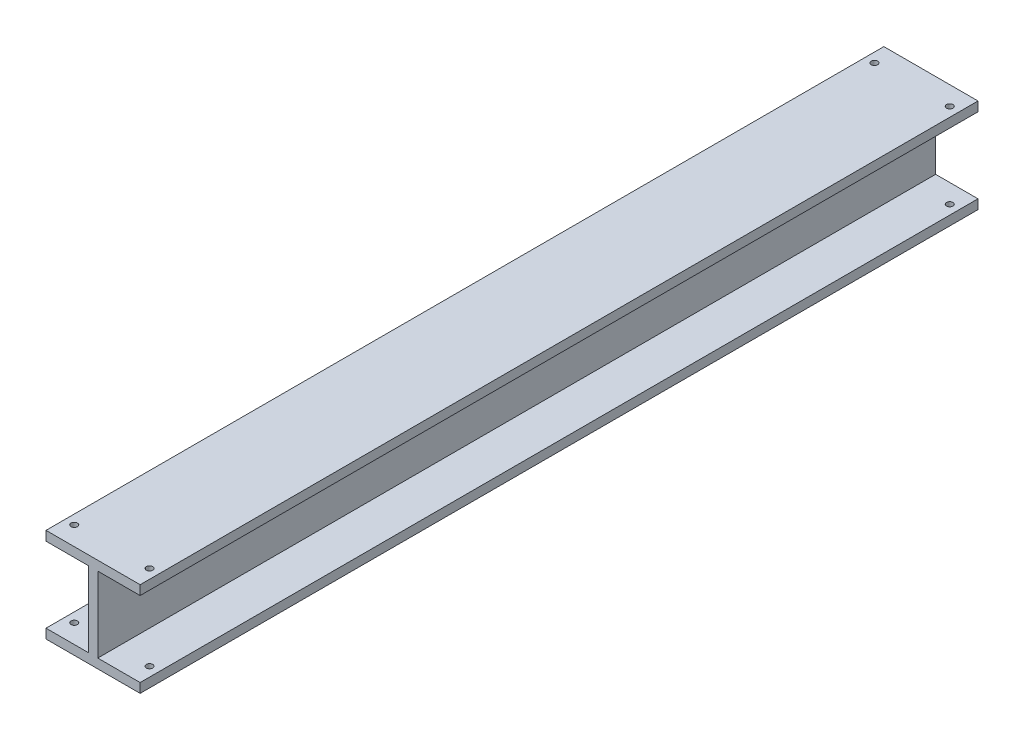
from build123d import *

# Parameters (mm, degrees)
AUFSATZ_LINEAR_AUSTRAGEN1_DEPTH = 890
SKIZZE2_R                       = 3.4
SCHNITT_LINEAR_AUSTRAGEN1_DEPTH = 897.994983264


with BuildPart() as part:
    # Skizze1 → Aufsatz-Linear austragen1 (new body)
    with BuildSketch(Plane.XY):
        Polygon((-50, 50), (50, 50), (50, 40), (5, 40), (5, -40), (50, -40), (50, -50), (-50, -50), (-50, -40), (-5, -40), (-5, 40), (-50, 40), align=None)
    extrude(amount=AUFSATZ_LINEAR_AUSTRAGEN1_DEPTH)

    # Skizze2 → Schnitt-Linear austragen1 (cut, through all)
    with BuildSketch(Plane(origin=(0, 50, 0), x_dir=(1, 0, 0), z_dir=(0, 1, 0))):
        with Locations(Location((40, -870, 0), (0, 0, 270))):
            Circle(SKIZZE2_R)
        with Locations(Location((-40, -870, 0), (0, 0, 180))):
            Circle(SKIZZE2_R)
    schnitt_linear_austragen1 = extrude(amount=-SCHNITT_LINEAR_AUSTRAGEN1_DEPTH, mode=Mode.SUBTRACT)

    # Spiegeln1: Schnitt-Linear austragen1 across plane
    add(schnitt_linear_austragen1.mirror(Plane.XY.offset(445)), mode=Mode.SUBTRACT)


solid = part.part
